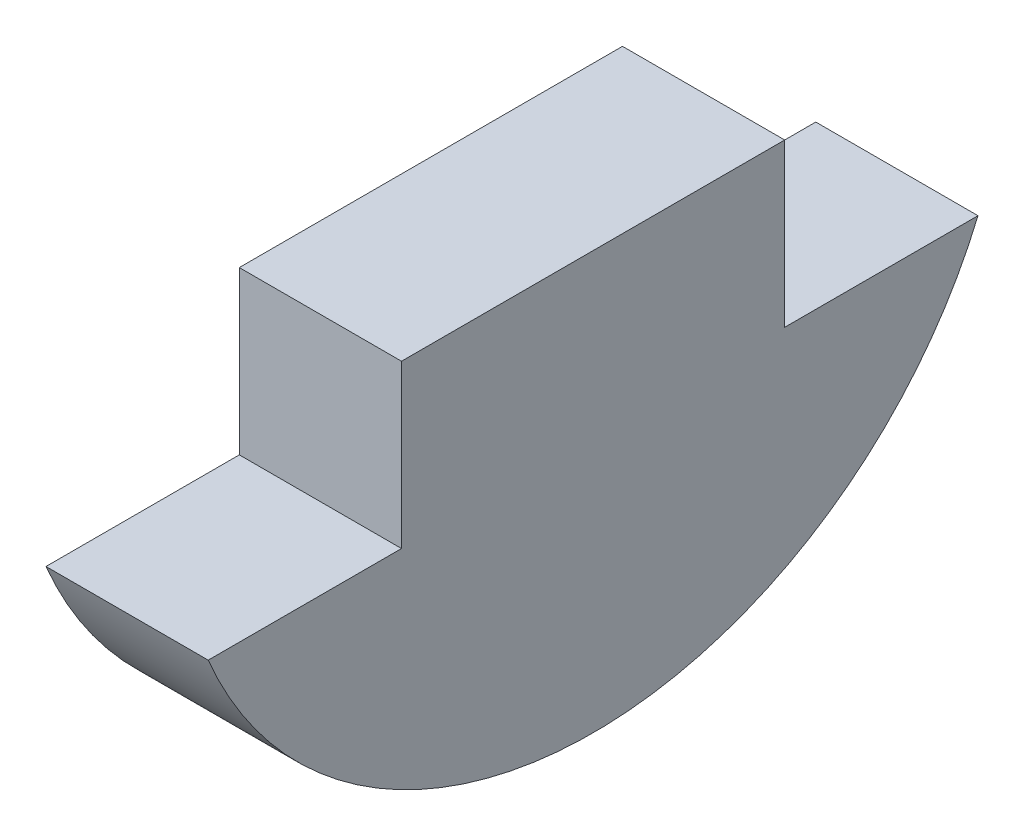
from build123d import *

# Parameters (mm, degrees)
BASE_DEPTH = 2.54


with BuildPart() as part:
    # Sketch1 → Base (new body)
    with BuildSketch(Plane(origin=(0, 0, 0), x_dir=(0, 0, -1), z_dir=(1, 0, 0))):
        with BuildLine():
            Line((-3, 0), (3, 0))
            Line((3, 0), (3, -2.54))
            Line((3, -2.54), (6.026607669, -2.54))
            ThreePointArc((6.026607669, -2.54), (0, -6.54), (-6.026607669, -2.54))
            Line((-6.026607669, -2.54), (-3, -2.54))
            Line((-3, -2.54), (-3, 0))
        make_face()
    extrude(amount=BASE_DEPTH)


solid = part.part
